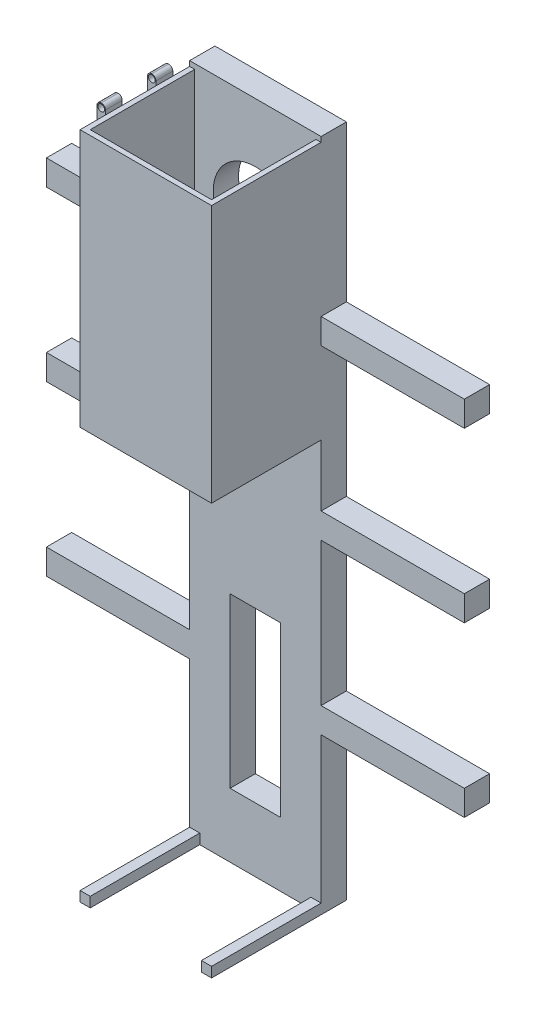
from build123d import *

# Parameters (mm, degrees)
IZIM1_W                          = 78
IZIM1_H                          = 400
Y_KSEKLIK_EKSTR_ZYON1_DEPTH      = 15
IZIM2_R                          = 25
KES_EKSTR_ZYON1_DEPTH            = 30
Y_KSEKLIK_EKSTR_ZYON2_DEPTH      = 85
Y_KSEKLIK_EKSTR_ZYON2_DEPTH_BACK = 163
IZIM3_W                          = 15
IZIM3_H                          = 15
KES_EKSTR_ZYON2_DEPTH            = 26
IZIM5_W                          = 6
IZIM5_H                          = 6
Y_KSEKLIK_EKSTR_ZYON3_DEPTH      = 65
IZIM6_R                          = 7
KES_EKSTR_ZYON3_DEPTH            = 65
IZIM8_W                          = 72
IZIM8_H                          = 3
Y_KSEKLIK_EKSTR_ZYON4_DEPTH      = 150
IZIM9_W                          = 10
IZIM9_H                          = 5
Y_KSEKLIK_EKSTR_ZYON5_DEPTH      = 5
IZIM12_W                         = 5
IZIM12_H                         = 10
Y_KSEKLIK_EKSTR_ZYON6_DEPTH      = 5
Y_KSEKLIK_EKSTR_ZYON7_DEPTH      = 10
Y_KSEKLIK_EKSTR_ZYON8_DEPTH      = 10
IZIM15_R                         = 2
KES_EKSTR_ZYON5_DEPTH            = 46
RADYUS1_R                        = 2.4
RADYUS2_R                        = 2.4
RADYUS3_R                        = 2.4
RADYUS4_R                        = 2.4


with BuildPart() as part:
    # Çizim1 → Yükseklik-Ekstrüzyon1 (new body)
    with BuildSketch(Plane.XY):
        with Locations((39, -200)):
            Rectangle(IZIM1_W, IZIM1_H)
    extrude(amount=Y_KSEKLIK_EKSTR_ZYON1_DEPTH)

    # Çizim2 → Kes-Ekstrüzyon1 (cut)
    with BuildSketch(Plane.XY.offset(15)):
        with Locations((39, -60)):
            Circle(IZIM2_R)
    extrude(amount=-KES_EKSTR_ZYON1_DEPTH, mode=Mode.SUBTRACT)

    # Çizim3 → Yükseklik-Ekstrüzyon2 (add, two sides: drawn at the far end of the back side and taken through both)
    with BuildSketch(Plane.ZY.offset(-Y_KSEKLIK_EKSTR_ZYON2_DEPTH_BACK)):
        with Locations((7.5, -200)):
            Rectangle(IZIM3_W, IZIM3_H)
        with Locations((7.5, -100)):
            Rectangle(IZIM3_W, IZIM3_H)
        with Locations((7.5, -300)):
            Rectangle(IZIM3_W, IZIM3_H)
    extrude(amount=Y_KSEKLIK_EKSTR_ZYON2_DEPTH + Y_KSEKLIK_EKSTR_ZYON2_DEPTH_BACK)

    # Çizim4 → Kes-Ekstrüzyon2 (cut)
    with BuildSketch(Plane.XY.offset(15)):
        Polygon((24, -261.99590857), (24, -361.99590857), (39, -361.99590857), (54, -361.99590857), (54, -261.99590857), align=None)
    extrude(amount=-KES_EKSTR_ZYON2_DEPTH, mode=Mode.SUBTRACT)

    # Çizim5 → Yükseklik-Ekstrüzyon3 (add)
    with BuildSketch(Plane.XY.offset(15)):
        Polygon((75, -3), (78, -3), (78, -156), (0, -156), (0, -3), (3, -3), (3, -153), (75, -153), align=None)
        with Locations((3, -397)):
            Rectangle(IZIM5_W, IZIM5_H)
        with Locations((75, -397)):
            Rectangle(IZIM5_W, IZIM5_H)
    extrude(amount=Y_KSEKLIK_EKSTR_ZYON3_DEPTH)

    # Çizim6 → Kes-Ekstrüzyon3 (cut)
    with BuildSketch(Plane(origin=(0, 0, 0), x_dir=(-1, 0, 0), z_dir=(0, 0, -1))):
        with Locations((-39, -140)):
            Circle(IZIM6_R)
    extrude(amount=-KES_EKSTR_ZYON3_DEPTH, mode=Mode.SUBTRACT)

    # Çizim8 → Yükseklik-Ekstrüzyon4 (add)
    with BuildSketch(Plane(origin=(0, -153, 0), x_dir=(1, 0, 0), z_dir=(0, 1, 0))):
        with Locations((39, -78.5)):
            Rectangle(IZIM8_W, IZIM8_H)
    extrude(amount=Y_KSEKLIK_EKSTR_ZYON4_DEPTH)

    # Çizim9 → Yükseklik-Ekstrüzyon5 (add)
    with BuildSketch(Plane.ZY):
        with Locations((60, -5.5)):
            Rectangle(IZIM9_W, IZIM9_H)
        with Locations((30, -5.5)):
            Rectangle(IZIM9_W, IZIM9_H)
    extrude(amount=Y_KSEKLIK_EKSTR_ZYON5_DEPTH)

    # Çizim12 → Yükseklik-Ekstrüzyon6 (add)
    with BuildSketch(Plane(origin=(0, -3, 0), x_dir=(1, 0, 0), z_dir=(0, 1, 0))):
        with Locations((-2.5, -30)):
            Rectangle(IZIM12_W, IZIM12_H)
        with Locations((-2.5, -60)):
            Rectangle(IZIM12_W, IZIM12_H)
    extrude(amount=Y_KSEKLIK_EKSTR_ZYON6_DEPTH)

    # Çizim13 → Yükseklik-Ekstrüzyon7 (add)
    with BuildSketch(Plane.XY.offset(65)):
        Polygon((-5, -8), (0, -8), (0, -13), align=None)
    extrude(amount=-Y_KSEKLIK_EKSTR_ZYON7_DEPTH)

    # Çizim14 → Yükseklik-Ekstrüzyon8 (add)
    with BuildSketch(Plane(origin=(0, 0, 25), x_dir=(-1, 0, 0), z_dir=(0, 0, -1))):
        Polygon((0, -8), (0, -13), (5, -8), align=None)
    extrude(amount=-Y_KSEKLIK_EKSTR_ZYON8_DEPTH)

    # Çizim15 → Kes-Ekstrüzyon5 (cut)
    with BuildSketch(Plane(origin=(0, 0, 25), x_dir=(-1, 0, 0), z_dir=(0, 0, -1))):
        with Locations((2.5, -0.5)):
            Circle(IZIM15_R)
    extrude(amount=-KES_EKSTR_ZYON5_DEPTH, mode=Mode.SUBTRACT)

    # Radyus1
    radyus1_edges = [part.edges().sort_by_distance(p)[0] for p in [
        (0, 2, 60),
    ]]
    fillet(radyus1_edges, radius=RADYUS1_R)

    # Radyus2
    radyus2_edges = [part.edges().sort_by_distance(p)[0] for p in [
        (0, 2, 30),
    ]]
    fillet(radyus2_edges, radius=RADYUS2_R)

    # Radyus3
    radyus3_edges = [part.edges().sort_by_distance(p)[0] for p in [
        (-5, 2, 30),
    ]]
    fillet(radyus3_edges, radius=RADYUS3_R)

    # Radyus4
    radyus4_edges = [part.edges().sort_by_distance(p)[0] for p in [
        (-5, 2, 60),
    ]]
    fillet(radyus4_edges, radius=RADYUS4_R)


solid = part.part
